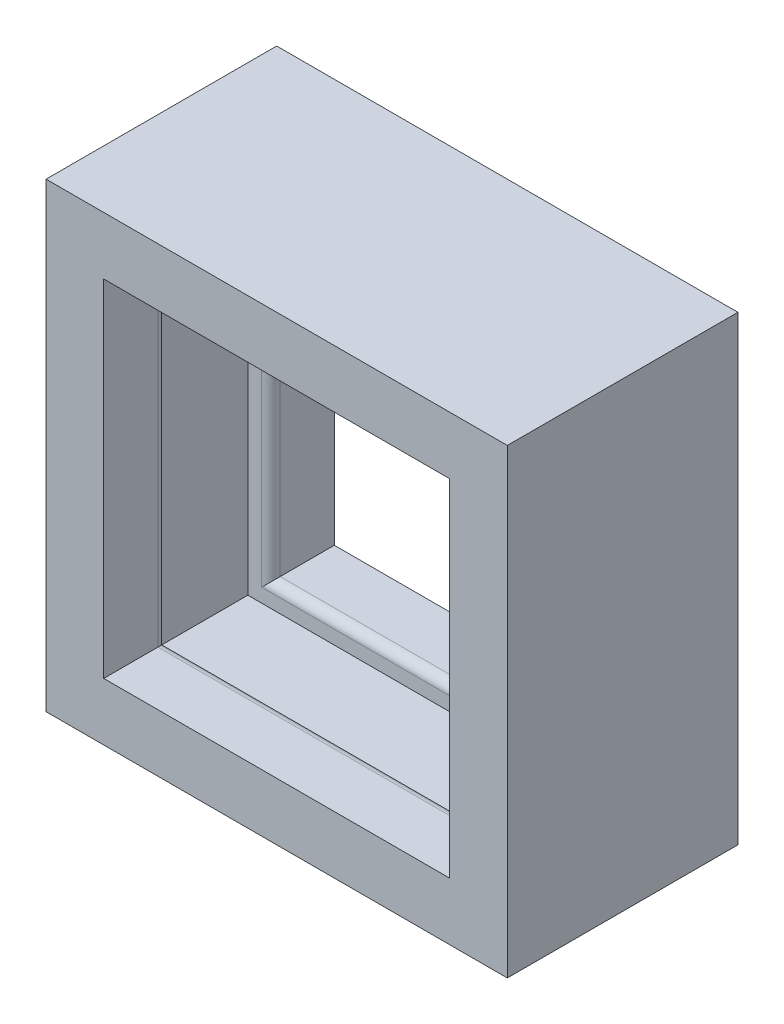
from build123d import *

# Parameters (mm, degrees)
SKETCH1_W           = 200
SKETCH1_H           = 200
SKETCH1_W_2         = 150
SKETCH1_H_2         = 150
BOSS_EXTRUDE1_DEPTH = 50
SKETCH2_W           = 170
SKETCH2_H           = 170
CUT_EXTRUDE1_DEPTH  = 22.5
FILLET1_R           = 4
FILLET2_R           = 4


with BuildPart() as part:
    # Sketch1 → Boss-Extrude1 (new, symmetric)
    with BuildSketch(Plane.XY):
        Rectangle(SKETCH1_W, SKETCH1_H)
        Rectangle(SKETCH1_W_2, SKETCH1_H_2, mode=Mode.SUBTRACT)
    extrude(amount=BOSS_EXTRUDE1_DEPTH, both=True)

    # Sketch2 → Cut-Extrude1 (cut, symmetric)
    with BuildSketch(Plane.XY):
        Rectangle(SKETCH2_W, SKETCH2_H)
    extrude(amount=CUT_EXTRUDE1_DEPTH, both=True, mode=Mode.SUBTRACT)

    # Fillet1
    fillet1_edges = [part.edges().sort_by_distance(p)[0] for p in [
        (0, -75, -22.5),
        (75, 0, -22.5),
        (0, 75, -22.5),
        (-75, 0, -22.5),
    ]]
    fillet(fillet1_edges, radius=FILLET1_R)

    # Fillet2
    fillet2_edges = [part.edges().sort_by_distance(p)[0] for p in [
        (0, -75, 22.5),
        (75, 0, 22.5),
        (0, 75, 22.5),
        (-75, 0, 22.5),
    ]]
    fillet(fillet2_edges, radius=FILLET2_R)


solid = part.part
